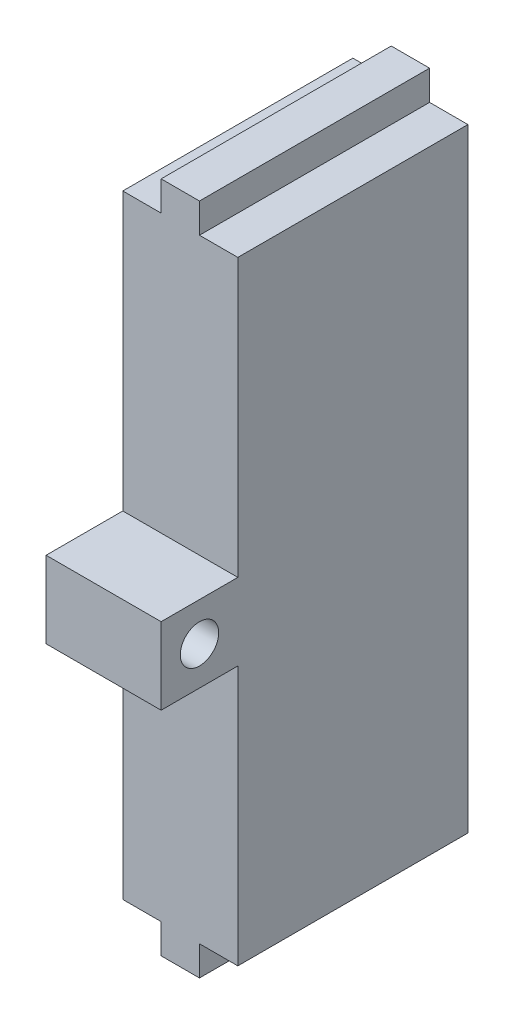
from build123d import *

# Parameters (mm, degrees)
BOSS_EXTRUDE1_DEPTH = 150
SKETCH2_W           = 75
SKETCH2_H           = 50
BOSS_EXTRUDE2_DEPTH = 50
SKETCH3_R           = 12.5
CUT_EXTRUDE1_DEPTH  = 167


with BuildPart() as part:
    # Sketch1 → Boss-Extrude1 (new body)
    with BuildSketch(Plane.XY):
        Polygon((25, 0), (25, 19.336654422), (50, 19.336654422), (50, 0), (75, 0), (75, -400), (50, -400), (50, -419.336654422), (25, -419.336654422), (25, -400), (0, -400), (0, 0), align=None)
    extrude(amount=BOSS_EXTRUDE1_DEPTH)

    # Sketch2 → Boss-Extrude2 (add)
    with BuildSketch(Plane.XY.offset(150)):
        with Locations((37.5, -205.663345578)):
            Rectangle(SKETCH2_W, SKETCH2_H)
    extrude(amount=BOSS_EXTRUDE2_DEPTH)

    # Sketch3 → Cut-Extrude1 (cut)
    with BuildSketch(Plane.ZY):
        with Locations(Location((175, -205.663345578, 0), (0, 0, 270))):
            Circle(SKETCH3_R)
    extrude(amount=-CUT_EXTRUDE1_DEPTH, mode=Mode.SUBTRACT)


solid = part.part
